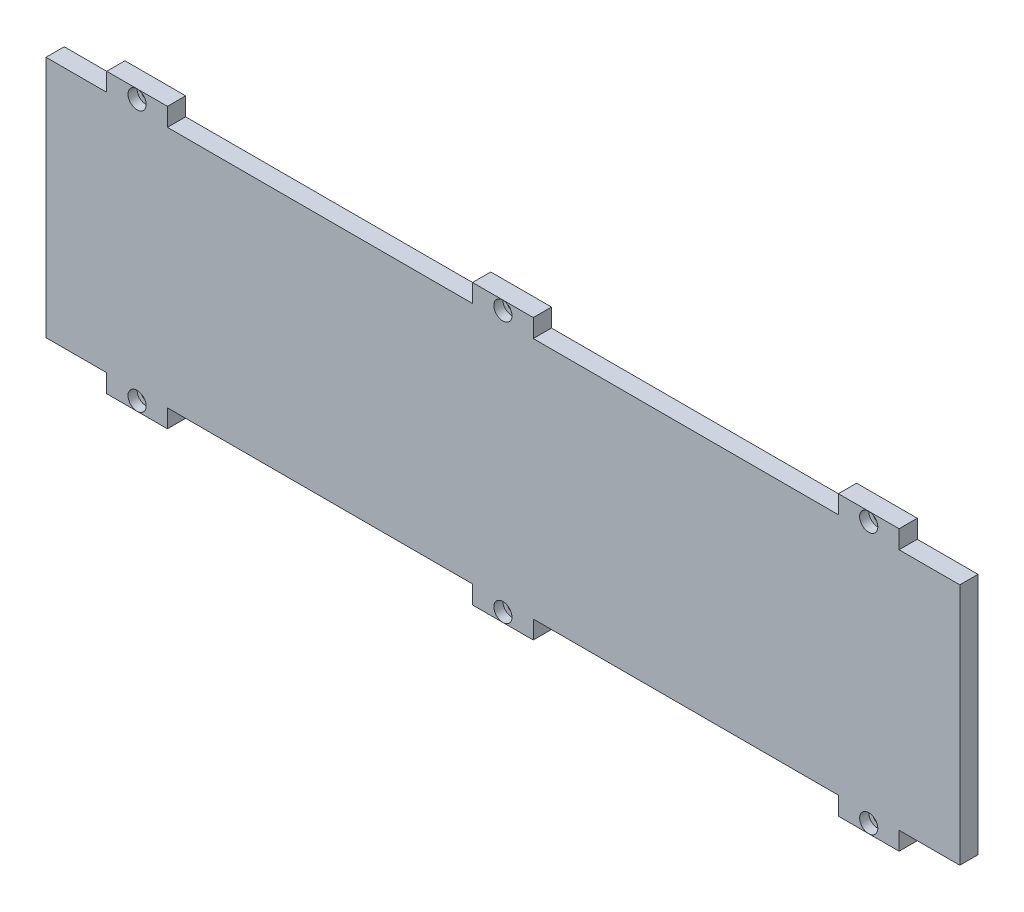
from build123d import *

# Parameters (mm, degrees)
BOSS_EXTRU_1_DEPTH      = 6
ESQUISSE2_R             = 1.5
ENL_V_MAT_EXTRU_1_DEPTH = 314.10221973
ESQUISSE3_R             = 2.995
ENL_V_MAT_EXTRU_2_DEPTH = 3


with BuildPart() as part:
    # Esquisse1 → Boss.-Extru.1 (new body)
    with BuildSketch(Plane.XY):
        Polygon((-40, 80), (-140.5, 80), (-140.5, 86), (-160.5, 86), (-160.5, 80), (-261, 80), (-261, 86), (-281, 86), (-281, 80), (-301, 80), (-301, 0), (-281, 0), (-281, -6), (-261, -6), (-261, 0), (-160.5, 0), (-160.5, -6), (-140.5, -6), (-140.5, 0), (-40, 0), (-40, -6), (-20, -6), (-20, 0), (0, 0), (0, 80), (-20, 80), (-20, 86), (-40, 86), align=None)
    extrude(amount=BOSS_EXTRU_1_DEPTH)

    # Esquisse2 → Enlèv. mat.-Extru.1 (cut, through all)
    with BuildSketch(Plane.XY.offset(6)):
        with Locations((-271, 83)):
            Circle(ESQUISSE2_R)
        with Locations((-150.5, 83)):
            Circle(ESQUISSE2_R)
        with Locations((-30, 83)):
            Circle(ESQUISSE2_R)
        with Locations(Location((-271, -3, 0), (0, 0, 180))):
            Circle(ESQUISSE2_R)
        with Locations(Location((-150.5, -3, 0), (0, 0, 180))):
            Circle(ESQUISSE2_R)
        with Locations(Location((-30, -3, 0), (0, 0, 180))):
            Circle(ESQUISSE2_R)
    extrude(amount=-ENL_V_MAT_EXTRU_1_DEPTH, mode=Mode.SUBTRACT)

    # Esquisse3 → Enlèv. mat.-Extru.2 (cut)
    with BuildSketch(Plane.XY.offset(6)):
        with Locations((-271, 83)):
            Circle(ESQUISSE3_R)
        with Locations((-150.5, 83)):
            Circle(ESQUISSE3_R)
        with Locations((-30, 83)):
            Circle(ESQUISSE3_R)
        with Locations(Location((-30, -3, 0), (0, 0, 180))):
            Circle(ESQUISSE3_R)
        with Locations(Location((-150.5, -3, 0), (0, 0, 180))):
            Circle(ESQUISSE3_R)
        with Locations(Location((-271, -3, 0), (0, 0, 180))):
            Circle(ESQUISSE3_R)
    extrude(amount=-ENL_V_MAT_EXTRU_2_DEPTH, mode=Mode.SUBTRACT)


solid = part.part
